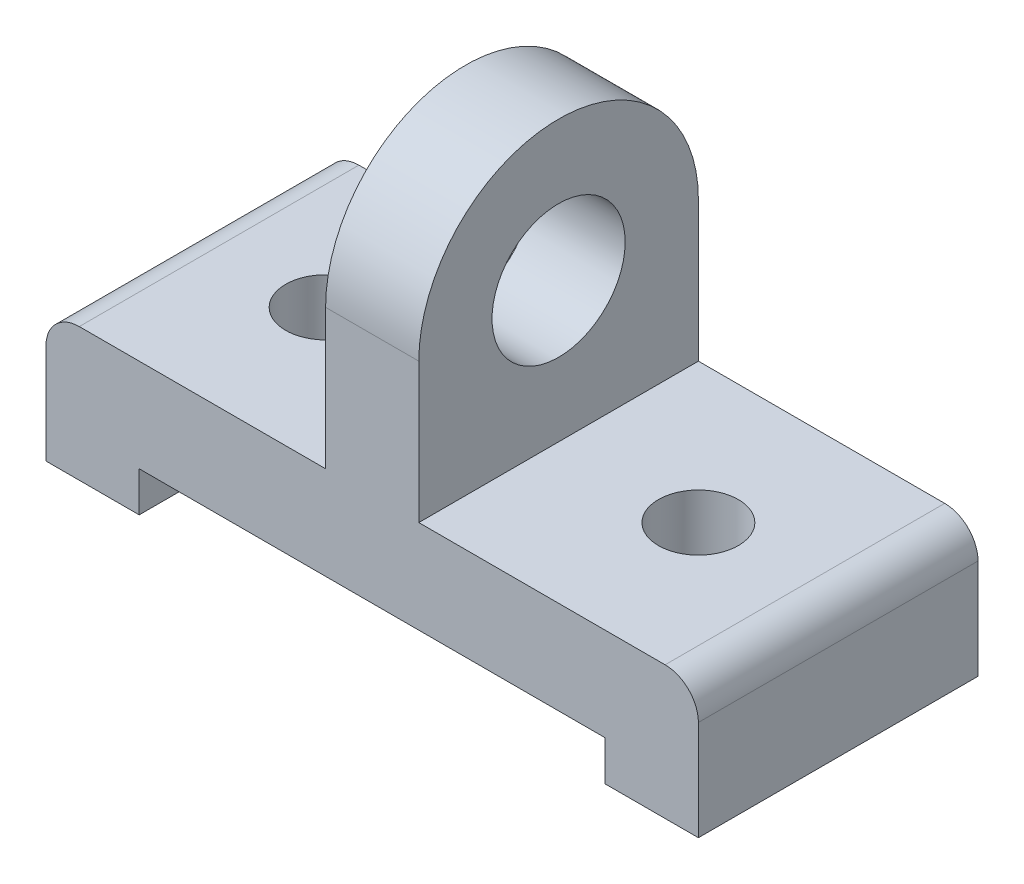
from build123d import *

# Parameters (mm, degrees)
SKETCH1_W           = 980
SKETCH1_H           = 420
BOSS_EXTRUDE1_DEPTH = 200
SKETCH2_W           = 700
SKETCH2_H           = 60
CUT_EXTRUDE1_DEPTH  = 420
SKETCH3_W           = 140
SKETCH3_H           = 420
BOSS_EXTRUDE2_DEPTH = 420
SKETCH4_R           = 100
CUT_EXTRUDE2_DEPTH  = 200
SKETCH5_R           = 60
CUT_EXTRUDE3_DEPTH  = 200
FILLET1_RADIUS      = 210
FILLET1_LENGTH      = 140
FILLET2_R           = 50
FILLET3_R           = 50


with BuildPart() as part:
    # Sketch1 → Boss-Extrude1 (new body)
    with BuildSketch(Plane(origin=(0, 0, 0), x_dir=(1, 0, 0), z_dir=(0, 1, 0))):
        with Locations((490, 210)):
            Rectangle(SKETCH1_W, SKETCH1_H)
    extrude(amount=BOSS_EXTRUDE1_DEPTH)

    # Sketch2 → Cut-Extrude1 (cut)
    with BuildSketch(Plane.XY):
        with Locations((490, 30)):
            Rectangle(SKETCH2_W, SKETCH2_H)
    extrude(amount=-CUT_EXTRUDE1_DEPTH, mode=Mode.SUBTRACT)

    # Sketch3 → Boss-Extrude2 (add)
    with BuildSketch(Plane.XY):
        with Locations((490, 410)):
            Rectangle(SKETCH3_W, SKETCH3_H)
    extrude(amount=-BOSS_EXTRUDE2_DEPTH)

    # Sketch4 → Cut-Extrude2 (cut)
    with BuildSketch(Plane(origin=(560, 0, 0), x_dir=(0, 0, -1), z_dir=(1, 0, 0))):
        with Locations((210, 410)):
            Circle(SKETCH4_R)
    extrude(amount=-CUT_EXTRUDE2_DEPTH, mode=Mode.SUBTRACT)

    # Sketch5 → Cut-Extrude3 (cut)
    with BuildSketch(Plane(origin=(0, 200, 0), x_dir=(1, 0, 0), z_dir=(0, 1, 0))):
        with Locations(Location((770, 210, 0), (0, 0, 270))):
            Circle(SKETCH5_R)
        with Locations(Location((210, 210, 0), (0, 0, 90))):
            Circle(SKETCH5_R)
    extrude(amount=-CUT_EXTRUDE3_DEPTH, mode=Mode.SUBTRACT)

    # Fillet1: full round fillet: the end face becomes a half cylinder, R = half its width
    fillet1_face = Plane((490, 620, -210), x_dir=(1, 0, 0), z_dir=(0, 1, 0))  # on the end face: x along it, z out of the body
    fillet1_slab = fillet1_face.offset(-FILLET1_RADIUS / 2) * Box(FILLET1_LENGTH, 2 * FILLET1_RADIUS, FILLET1_RADIUS, mode=Mode.PRIVATE)  # the body's end, R deep
    fillet1_round = Plane((490, 410, -210), x_dir=(0, 1, 0), z_dir=(1, 0, 0)) * Cylinder(FILLET1_RADIUS, FILLET1_LENGTH, mode=Mode.PRIVATE)  # its axis R under the face
    add(fillet1_slab - fillet1_round, mode=Mode.SUBTRACT)

    # Fillet2
    fillet2_edges = [part.edges().sort_by_distance(p)[0] for p in [
        (980, 200, -210),
    ]]
    fillet(fillet2_edges, radius=FILLET2_R)

    # Fillet3
    fillet3_edges = [part.edges().sort_by_distance(p)[0] for p in [
        (0, 200, -210),
    ]]
    fillet(fillet3_edges, radius=FILLET3_R)


solid = part.part
